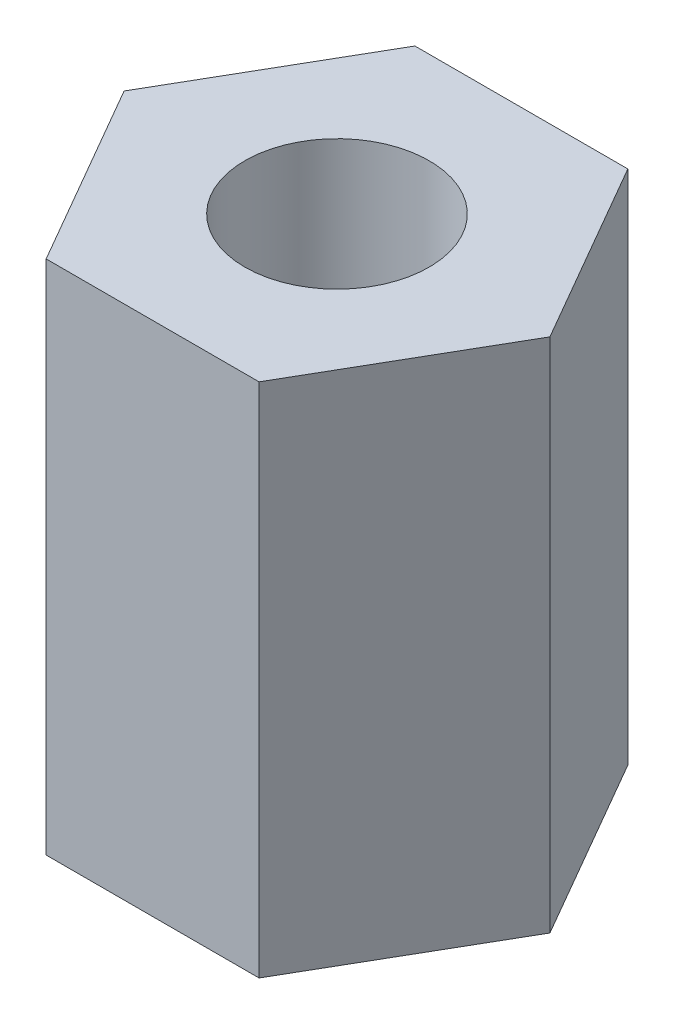
from build123d import *

# Parameters (mm, degrees)
SKETCH_1_R      = 1.25
EXTRUDE_1_DEPTH = 7


with BuildPart() as part:
    # 草图1 → 凸台-拉伸1 (new body)
    with BuildSketch(Plane.XZ):
        Polygon((-1.443375673, -2.5), (1.443375673, -2.5), (2.886751346, 0), (1.443375673, 2.5), (-1.443375673, 2.5), (-2.886751346, 0), align=None)
        with Locations(Location((0, 0, 0), (0, 0, 90))):
            Circle(SKETCH_1_R, mode=Mode.SUBTRACT)
    extrude(amount=-EXTRUDE_1_DEPTH)


solid = part.part
